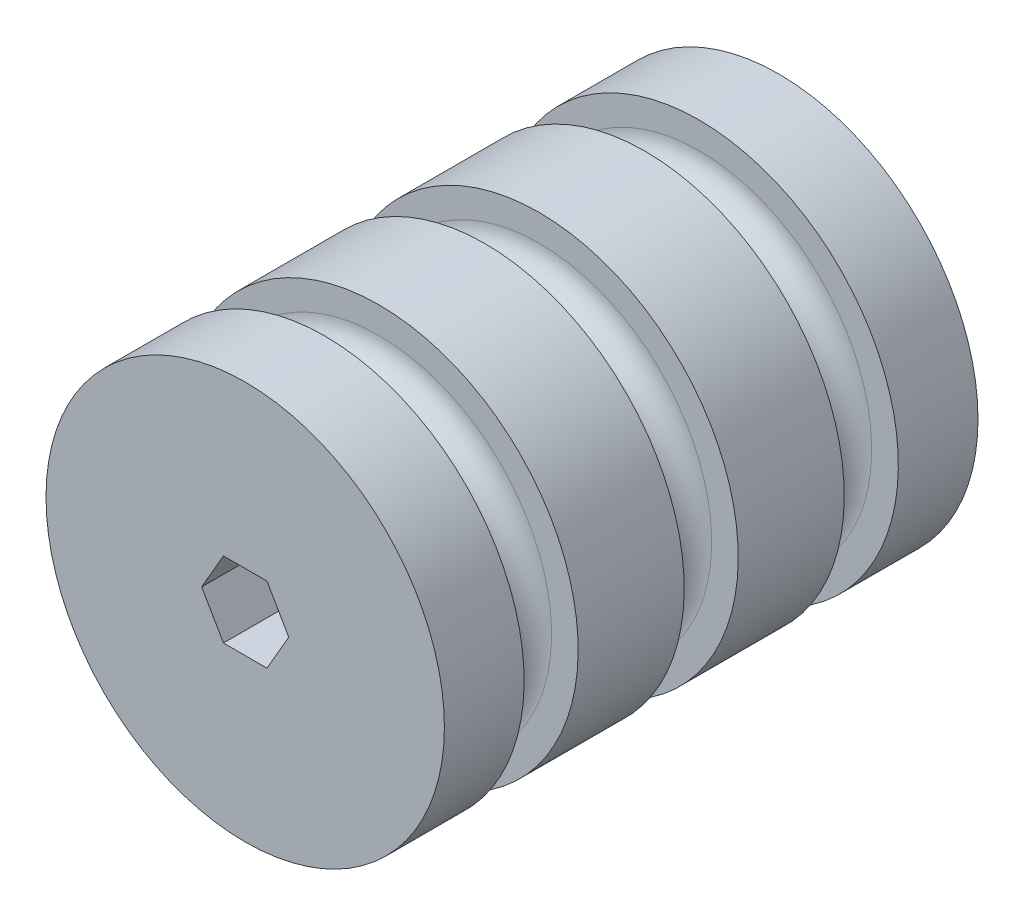
from build123d import *

# Parameters (mm, degrees)
SKETCH1_R           = 35.56
BOSS_EXTRUDE1_DEPTH = 95.25


with BuildPart() as part:
    # Sketch1 → Boss-Extrude1 (new body)
    with BuildSketch(Plane.XY):
        Circle(SKETCH1_R)
        Polygon((-3.886144662, 6.731), (3.886144662, 6.731), (7.772289324, 0), (3.886144662, -6.731), (-3.886144662, -6.731), (-7.772289324, 0), align=None, mode=Mode.SUBTRACT)
    extrude(amount=BOSS_EXTRUDE1_DEPTH)

    # Sketch2 → Cut-Revolve1 (revolve, cut)
    with BuildSketch(Plane(origin=(0, 0, 0), x_dir=(0, 0, -1), z_dir=(1, 0, 0))):
        with BuildLine():
            Line((-81.026, 35.56), (-71.374, 35.56))
            Line((-71.374, 35.56), (-71.374, 30.8102))
            ThreePointArc((-71.374, 30.8102), (-76.2, 25.9842), (-81.026, 30.8102))
            Line((-81.026, 30.8102), (-81.026, 35.56))
        make_face()
        with BuildLine():
            Line((-52.451, 30.8102), (-52.451, 35.56))
            Line((-52.451, 35.56), (-42.799, 35.56))
            Line((-42.799, 35.56), (-42.799, 30.8102))
            ThreePointArc((-42.799, 30.8102), (-47.625, 25.9842), (-52.451, 30.8102))
        make_face()
        with BuildLine():
            Line((-23.876, 30.8102), (-23.876, 35.56))
            Line((-23.876, 35.56), (-14.224, 35.56))
            Line((-14.224, 35.56), (-14.224, 30.8102))
            ThreePointArc((-14.224, 30.8102), (-19.05, 25.9842), (-23.876, 30.8102))
        make_face()
    revolve(axis=Axis((0, 0, 0), (0, 0, 1)), mode=Mode.SUBTRACT)


solid = part.part
